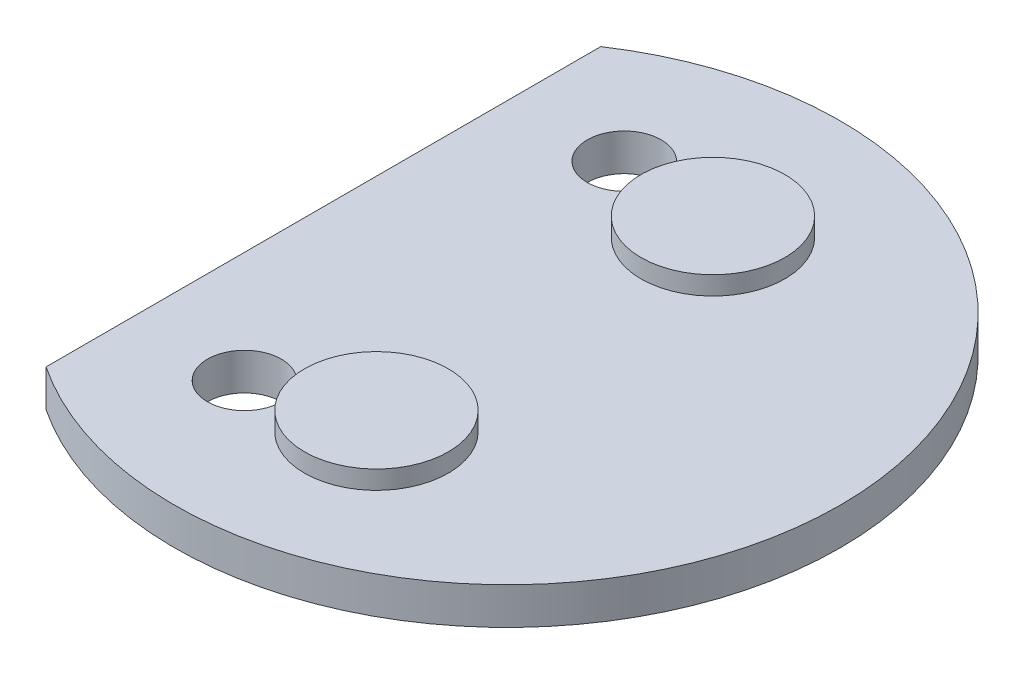
from build123d import *

# Parameters (mm, degrees)
RESSALTO_EXTRUS_O2_DEPTH   = 1.5
ESBO_O5_R                  = 15.72745668
ESBO_O5_R_2                = 1.945049623
CORTE_EXTRUS_O1_DEPTH      = 0.5
CORTE_EXTRUS_O2_DEPTH      = 24.840358488
CORTE_EXTRUS_O2_DEPTH_BACK = 24.840358488
ESBO_O7_R                  = 1


with BuildPart() as part:
    # Esboço4 → Ressalto-extrusão2 (new body)
    with BuildSketch(Plane(origin=(0, 0, 0), x_dir=(1, 0, 0), z_dir=(0, 1, 0))):
        with BuildLine():
            ThreePointArc((18.945063587, -5.437702675), (14.200975083, 2.492443436), (4.970126401, 2.062297325))
            Line((4.970126401, 2.062297325), (4.970126401, -12.937702675))
            ThreePointArc((4.970126401, -12.937702675), (14.200975083, -13.367848785), (18.945063587, -5.437702675))
        make_face()
    extrude(amount=RESSALTO_EXTRUS_O2_DEPTH)

    # Esboço5 → Corte-extrusão1 (cut)
    with BuildSketch(Plane(origin=(0, 1.5, 0), x_dir=(1, 0, 0), z_dir=(0, 1, 0))):
        with Locations((8.279998828, -5.161239755)):
            Circle(ESBO_O5_R)
        with Locations(Location((10.953382727, -0.888525014, 0), (0, 0, 270))):
            Circle(ESBO_O5_R_2, mode=Mode.SUBTRACT)
        with Locations(Location((10.953382727, -9.986880335, 0), (0, 0, 270))):
            Circle(ESBO_O5_R_2, mode=Mode.SUBTRACT)
    extrude(amount=-CORTE_EXTRUS_O1_DEPTH, mode=Mode.SUBTRACT)

    # Esboço7 → Corte-extrusão2 (cut, two sides: drawn at the far end of the back side and taken through both)
    with BuildSketch(Plane(origin=(0, 1, 0), x_dir=(1, 0, 0), z_dir=(0, 1, 0)).offset(-CORTE_EXTRUS_O2_DEPTH_BACK)):
        with Locations(Location((7.970126401, -10.572389641, 0), (0, 0, 270))):
            Circle(ESBO_O7_R)
        with Locations(Location((7.970126401, -0.303015709, 0), (0, 0, 270))):
            Circle(ESBO_O7_R)
    extrude(amount=CORTE_EXTRUS_O2_DEPTH + CORTE_EXTRUS_O2_DEPTH_BACK, mode=Mode.SUBTRACT)


solid = part.part
